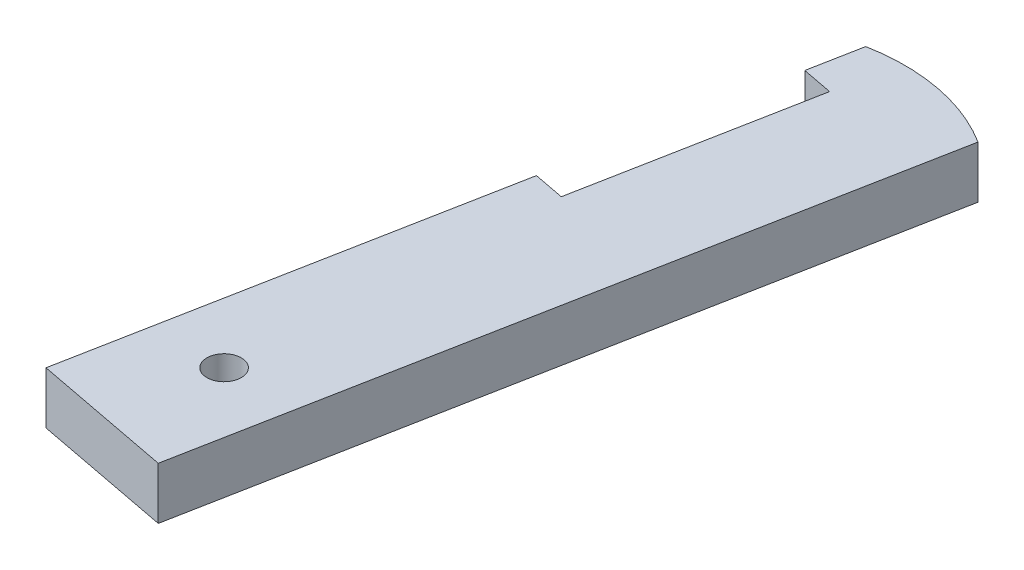
from build123d import *

# Parameters (mm, degrees)
SKETCH1_R           = 1.65
BOSS_EXTRUDE1_DEPTH = 5


with BuildPart() as part:
    # Sketch1 → Boss-Extrude1 (new body)
    with BuildSketch(Plane(origin=(0, 0, 0), x_dir=(1, 0, 0), z_dir=(0, 1, 0))):
        with BuildLine():
            Line((-3.423439206, 18.180485802), (-4.363345829, 13.269622789))
            Line((-4.363345829, 13.269622789), (-1.416828021, 12.705678814))
            Line((-1.416828021, 12.705678814), (-5.552417165, -8.902118446))
            Line((-5.552417165, -8.902118446), (-8.498934973, -8.338174471))
            Line((-8.498934973, -8.338174471), (-16.058196483, -47.834116755))
            Line((-16.058196483, -47.834116755), (-2.73993599, -50.383143518))
            Line((-2.73993599, -50.383143518), (9.894821287, 15.631459039))
            ThreePointArc((9.894821287, 15.631459039), (3.477654507, 18.170193151), (-3.423439206, 18.180485802))
        make_face()
        with Locations(Location((-7.519252989, -39.286904109, 0), (0, 0, 270))):
            Circle(SKETCH1_R, mode=Mode.SUBTRACT)
    extrude(amount=BOSS_EXTRUDE1_DEPTH)


solid = part.part
